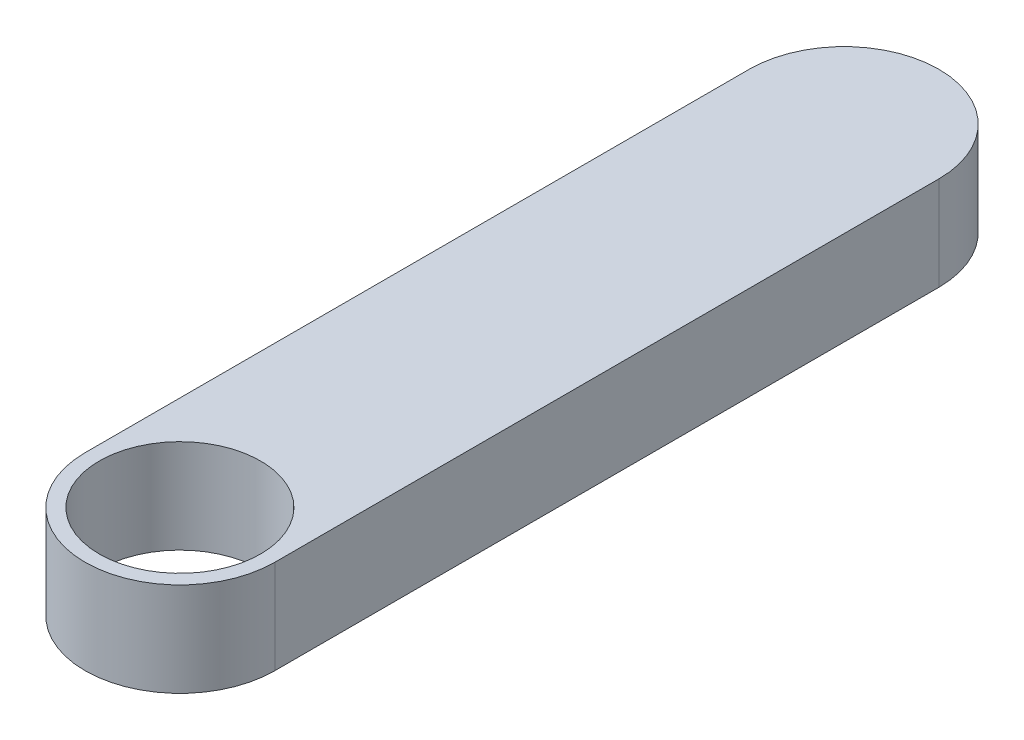
from build123d import *

# Parameters (mm, degrees)
BOSS_EXTRUDE1_DEPTH = 99
SKETCH2_R           = 85
CUT_EXTRUDE1_DEPTH  = 99


with BuildPart() as part:
    # Sketch1 → Boss-Extrude1 (new body)
    with BuildSketch(Plane(origin=(0, 0, 0), x_dir=(1, 0, 0), z_dir=(0, 1, 0))):
        with BuildLine():
            ThreePointArc((-100, 0), (0, -100), (100, 0))
            Line((100, 0), (-100, 0))
        make_face()
        with BuildLine():
            Line((-100, 0), (100, 0))
            ThreePointArc((100, 0), (0, 100), (-100, 0))
        make_face()
        with BuildLine():
            ThreePointArc((-100, 0), (0, 100), (100, 0))
            Line((100, 0), (100, 700))
            ThreePointArc((100, 700), (0, 600), (-100, 700))
            Line((-100, 700), (-100, 0))
        make_face()
        with BuildLine():
            ThreePointArc((-100, 700), (0, 600), (100, 700))
            Line((100, 700), (-100, 700))
        make_face()
        with BuildLine():
            Line((-100, 700), (100, 700))
            ThreePointArc((100, 700), (0, 800), (-100, 700))
        make_face()
    extrude(amount=BOSS_EXTRUDE1_DEPTH)

    # Sketch2 → Cut-Extrude1 (cut)
    with BuildSketch(Plane(origin=(0, 99, 0), x_dir=(1, 0, 0), z_dir=(0, 1, 0))):
        with Locations(Location((0, 0, 0), (0, 0, 270))):
            Circle(SKETCH2_R)
    extrude(amount=-CUT_EXTRUDE1_DEPTH, mode=Mode.SUBTRACT)


solid = part.part
